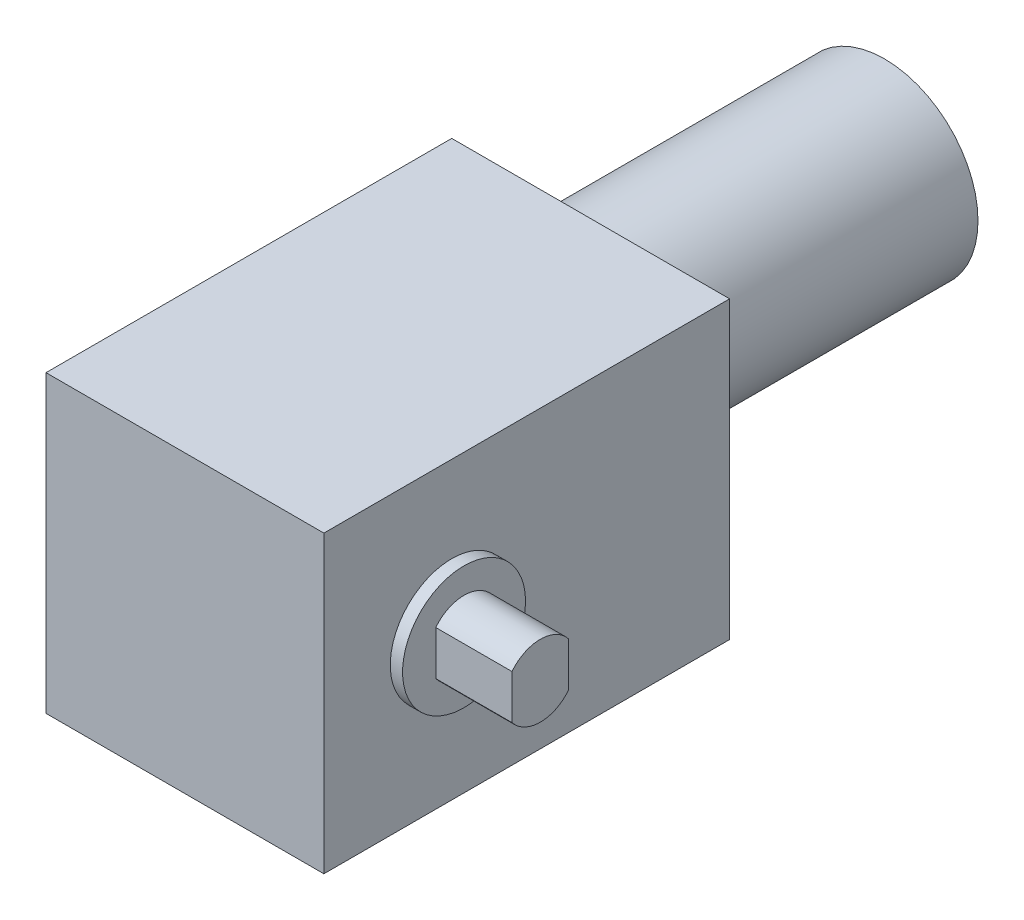
from build123d import *

# Parameters (mm, degrees)
SKETCH1_W             = 16.5
SKETCH1_H             = 12
BASE_DEPTH            = 11.3
SKETCH2_R             = 2.5
AXLE_BASE_DEPTH       = 0.5
AXLE_DEPTH            = 3.1
SKETCH4_R             = 3.8
WIRE_HOUSING_DEPTH    = 13.8
SKETCH5_R             = 1.25
RANDOM_ASS_BUMP_DEPTH = 0.4


with BuildPart() as part:
    # Sketch1 → Base (new body)
    with BuildSketch(Plane(origin=(0, 0, 0), x_dir=(0, 0, -1), z_dir=(1, 0, 0))):
        with Locations((3.05, 0)):
            Rectangle(SKETCH1_W, SKETCH1_H)
    extrude(amount=-BASE_DEPTH)

    # Sketch2 → Axle Base (add)
    with BuildSketch(Plane(origin=(0, 0, 0), x_dir=(0, 0, -1), z_dir=(1, 0, 0))):
        Circle(SKETCH2_R)
    extrude(amount=AXLE_BASE_DEPTH)

    # Sketch3 → Axle (add)
    with BuildSketch(Plane(origin=(0.5, 0, 0), x_dir=(0, 0, -1), z_dir=(1, 0, 0))):
        with BuildLine():
            Line((1.15, 0.899499861), (1.15, -0.899499861))
            ThreePointArc((1.15, -0.899499861), (0, -1.46), (-1.15, -0.899499861))
            Line((-1.15, -0.899499861), (-1.15, 0.899499861))
            ThreePointArc((-1.15, 0.899499861), (0, 1.46), (1.15, 0.899499861))
        make_face()
    extrude(amount=AXLE_DEPTH)

    # Sketch4 → Wire Housing (add)
    with BuildSketch(Plane(origin=(0, 0, -11.3), x_dir=(-1, 0, 0), z_dir=(0, 0, -1))):
        with Locations((7.5, 0)):
            Circle(SKETCH4_R)
    extrude(amount=WIRE_HOUSING_DEPTH)

    # Sketch5 → Random-ass Bump (add)
    with BuildSketch(Plane.ZY.offset(11.3)):
        with Locations(Location((-5.3, 0, 0), (0, 0, 180))):
            Circle(SKETCH5_R)
    extrude(amount=RANDOM_ASS_BUMP_DEPTH)


solid = part.part
